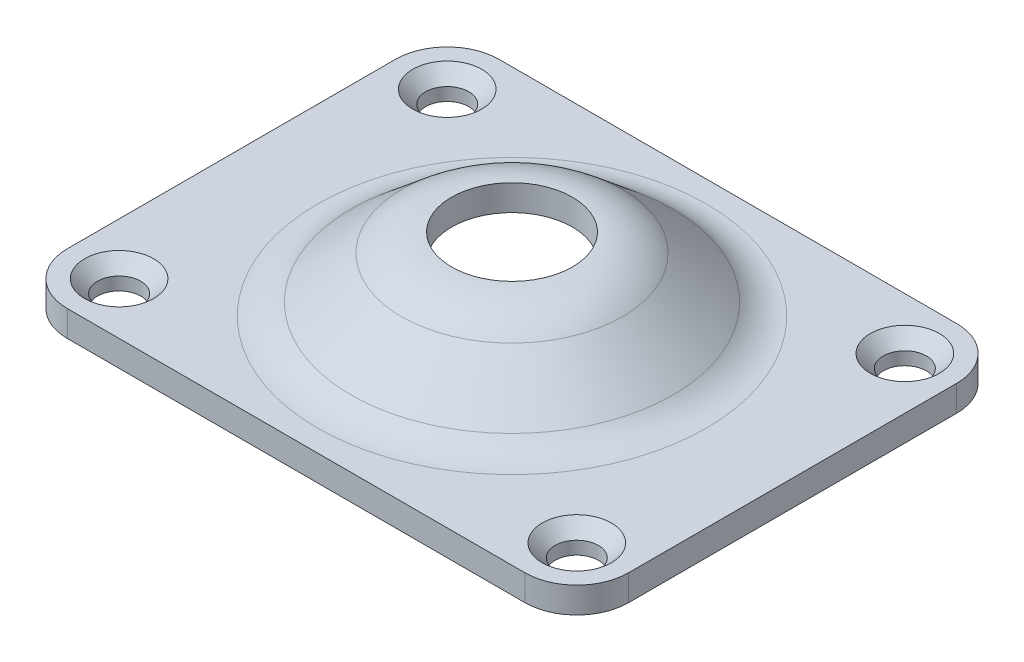
from build123d import *

# Parameters (mm, degrees)
SKETCH1_R           = 2.5
SKETCH1_R_2         = 22.5
BOSS_EXTRUDE1_DEPTH = 3
CHAMFER1_SIZE       = 1.5


with BuildPart() as part:
    # Sketch1 → Boss-Extrude1 (new body)
    with BuildSketch(Plane(origin=(0, 0, 0), x_dir=(1, 0, 0), z_dir=(0, 1, 0))):
        with BuildLine():
            Line((-26.5, 25), (26.5, 25))
            ThreePointArc((26.5, 25), (30.742640687, 23.242640687), (32.5, 19))
            Line((32.5, 19), (32.5, -19))
            ThreePointArc((32.5, -19), (30.742640687, -23.242640687), (26.5, -25))
            Line((26.5, -25), (-26.5, -25))
            ThreePointArc((-26.5, -25), (-30.742640687, -23.242640687), (-32.5, -19))
            Line((-32.5, -19), (-32.5, 19))
            ThreePointArc((-32.5, 19), (-30.742640687, 23.242640687), (-26.5, 25))
        make_face()
        with Locations(Location((-26.5, 19, 0), (0, 0, 270))):
            Circle(SKETCH1_R, mode=Mode.SUBTRACT)
        with Locations(Location((26.5, 19, 0), (0, 0, 270))):
            Circle(SKETCH1_R, mode=Mode.SUBTRACT)
        with Locations(Location((-26.5, -19, 0), (0, 0, 270))):
            Circle(SKETCH1_R, mode=Mode.SUBTRACT)
        with Locations(Location((26.5, -19, 0), (0, 0, 270))):
            Circle(SKETCH1_R, mode=Mode.SUBTRACT)
        with Locations(Location((0, 0, 0), (0, 0, 270))):
            Circle(SKETCH1_R_2, mode=Mode.SUBTRACT)
    extrude(amount=BOSS_EXTRUDE1_DEPTH)

    # Chamfer1
    chamfer1_edges = [part.edges().sort_by_distance(p)[0] for p in [
        (-26.5, 3, -21.5),
        (26.5, 3, -21.5),
        (-26.5, 3, 16.5),
        (26.5, 3, 16.5),
    ]]
    chamfer(chamfer1_edges, length=CHAMFER1_SIZE)

    # Sketch4 → Revolve1 (revolve)
    with BuildSketch(Plane.XY, mode=Mode.PRIVATE) as revolve1_sk:
        with BuildLine():
            Line((-16.714911513, 2.105600012), (-10.856725658, 7.021201602))
            ThreePointArc((-10.856725658, 7.021201602), (-9.05212086, 8.063090668), (-7, 8.424934943))
            Line((-7, 8.424934943), (-7, 11.424934943))
            ThreePointArc((-7, 11.424934943), (-10.07818129, 10.88216853), (-12.785088487, 9.319334931))
            Line((-12.785088487, 9.319334931), (-18.643274342, 4.403733341))
            ThreePointArc((-18.643274342, 4.403733341), (-20.44787914, 3.361844275), (-22.5, 3))
            Line((-22.5, 3), (-22.5, 0))
            ThreePointArc((-22.5, 0), (-19.42181871, 0.542766413), (-16.714911513, 2.105600012))
        make_face()
    revolve(revolve1_sk.sketch.rotate(Axis((0, 0, 0), (0, 1, 0)), 270), axis=Axis((0, 0, 0), (0, 1, 0)))


solid = part.part
